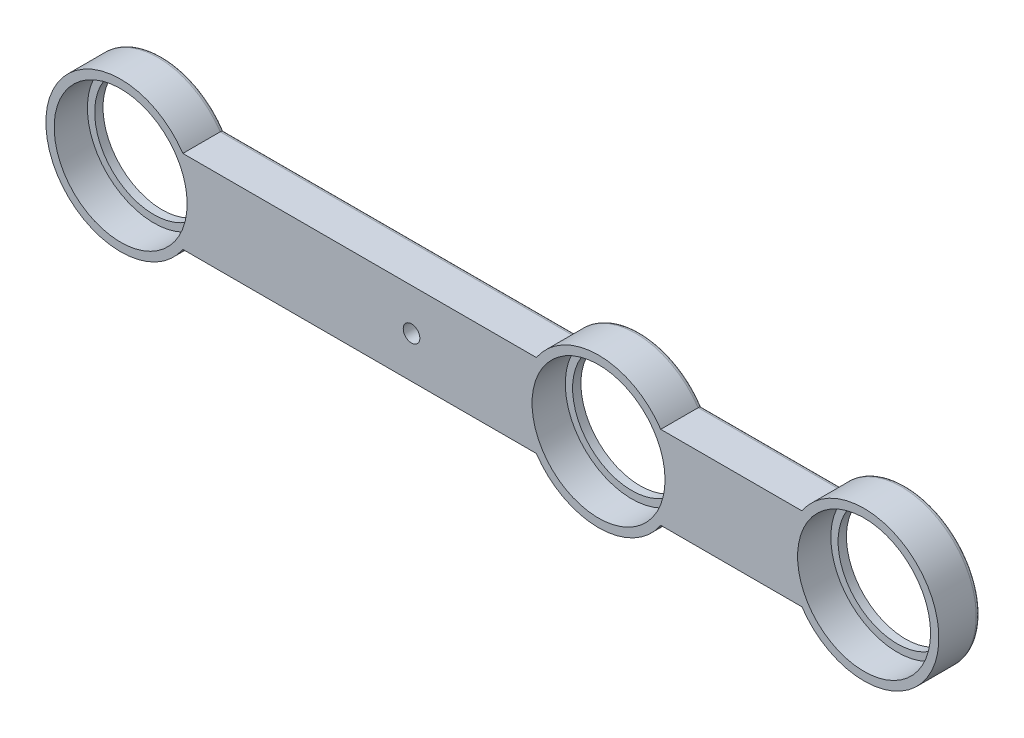
from build123d import *

# Parameters (mm, degrees)
BOSS_EXTRU_1_DEPTH      = 4
ESQUISSE6_R             = 16
ENL_V_MAT_EXTRU_1_DEPTH = 2
ESQUISSE7_R             = 14.25
ENL_V_MAT_EXTRU_2_DEPTH = 135.227418958
ESQUISSE10_R            = 16
BOSS_EXTRU_5_DEPTH      = 6
CONG_1_R                = 1
ESQUISSE12_R            = 2
ENL_V_MAT_EXTRU_3_DEPTH = 135.58454603


with BuildPart() as part:
    # Esquisse1 → Boss.-Extru.1 (new body)
    with BuildSketch(Plane.XY):
        with BuildLine():
            Line((-100.033370453, 10), (-14.966629547, 10))
            ThreePointArc((-14.966629547, 10), (0, 18), (14.966629547, 10))
            Line((14.966629547, 10), (48.933370453, 10))
            ThreePointArc((48.933370453, 10), (81.9, 0), (48.933370453, -10))
            Line((48.933370453, -10), (14.966629547, -10))
            ThreePointArc((14.966629547, -10), (0, -18), (-14.966629547, -10))
            Line((-14.966629547, -10), (-100.033370453, -10))
            ThreePointArc((-100.033370453, -10), (-133, 0), (-100.033370453, 10))
        make_face()
    extrude(amount=BOSS_EXTRU_1_DEPTH)

    # Esquisse6 → Enlèv. mat.-Extru.1 (cut)
    with BuildSketch(Plane.XY.offset(4)):
        with Locations((-115, 0)):
            Circle(ESQUISSE6_R)
        Circle(ESQUISSE6_R)
        with Locations((63.9, 0)):
            Circle(ESQUISSE6_R)
    extrude(amount=-ENL_V_MAT_EXTRU_1_DEPTH, mode=Mode.SUBTRACT)

    # Esquisse7 → Enlèv. mat.-Extru.2 (cut, through all)
    with BuildSketch(Plane.XY.offset(2)):
        with Locations((-115, 0)):
            Circle(ESQUISSE7_R)
        Circle(ESQUISSE7_R)
        with Locations((63.9, 0)):
            Circle(ESQUISSE7_R)
    extrude(amount=-ENL_V_MAT_EXTRU_2_DEPTH, mode=Mode.SUBTRACT)

    # Esquisse10 → Boss.-Extru.5 (add)
    with BuildSketch(Plane.XY.offset(4)):
        with BuildLine():
            Line((-100.033370453, -10), (-14.966629547, -10))
            ThreePointArc((-14.966629547, -10), (0, -18), (14.966629547, -10))
            Line((14.966629547, -10), (48.933370453, -10))
            ThreePointArc((48.933370453, -10), (81.9, 0), (48.933370453, 10))
            Line((48.933370453, 10), (14.966629547, 10))
            ThreePointArc((14.966629547, 10), (0, 18), (-14.966629547, 10))
            Line((-14.966629547, 10), (-100.033370453, 10))
            ThreePointArc((-100.033370453, 10), (-133, 0), (-100.033370453, -10))
        make_face()
        with Locations((63.9, 0)):
            Circle(ESQUISSE10_R, mode=Mode.SUBTRACT)
        Circle(ESQUISSE10_R, mode=Mode.SUBTRACT)
        with Locations((-115, 0)):
            Circle(ESQUISSE10_R, mode=Mode.SUBTRACT)
    extrude(amount=BOSS_EXTRU_5_DEPTH)

    # Congé1
    cong_1_edges = [part.edges().sort_by_distance(p)[0] for p in [
        (31.95, -10, 0),
        (0, -18, 0),
        (-57.5, -10, 0),
        (-133, 0, 0),
        (-57.5, 10, 0),
        (0, 18, 0),
        (31.95, 10, 0),
        (81.9, 0, 0),
    ]]
    fillet(cong_1_edges, radius=CONG_1_R)

    # Esquisse12 → Enlèv. mat.-Extru.3 (cut, through all)
    with BuildSketch(Plane(origin=(0, 0, 0), x_dir=(-1, 0, 0), z_dir=(0, 0, -1))):
        with Locations((45, 0)):
            Circle(ESQUISSE12_R)
    extrude(amount=-ENL_V_MAT_EXTRU_3_DEPTH, mode=Mode.SUBTRACT)


solid = part.part
